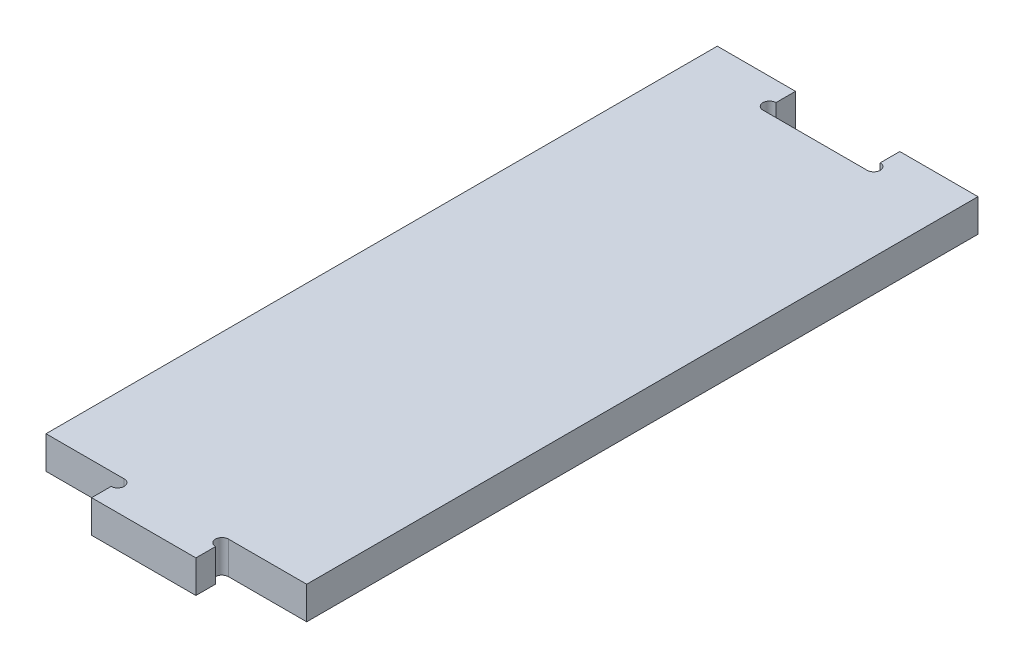
from build123d import *

# Parameters (mm, degrees)
SKETCH_1_W          = 40
SKETCH_1_H          = 103
EXTRUDE_1_DEPTH     = 5
SKETCH_2_W          = 16
SKETCH_2_H          = 5
CUT_EXTRUDE_2_DEPTH = 5
SKETCH_3_W          = 16
SKETCH_3_H          = 5
EXTRUDE_3_DEPTH     = 5
SKETCH_4_R          = 1
CUT_EXTRUDE_3_DEPTH = 10


with BuildPart() as part:
    # 스케치1 → 보스-돌출1 (new body)
    with BuildSketch(Plane(origin=(0, 0, 0), x_dir=(1, 0, 0), z_dir=(0, 1, 0))):
        with Locations((20, 51.5)):
            Rectangle(SKETCH_1_W, SKETCH_1_H)
    extrude(amount=EXTRUDE_1_DEPTH)

    # 스케치2 → 컷-돌출2 (cut)
    with BuildSketch(Plane(origin=(0, 5, 0), x_dir=(1, 0, 0), z_dir=(0, 1, 0))):
        with Locations((20, 100.5)):
            Rectangle(SKETCH_2_W, SKETCH_2_H)
    extrude(amount=-CUT_EXTRUDE_2_DEPTH, mode=Mode.SUBTRACT)

    # 스케치3 → 보스-돌출3 (add)
    with BuildSketch(Plane(origin=(0, 5, 0), x_dir=(1, 0, 0), z_dir=(0, 1, 0))):
        with Locations((20, -2.5)):
            Rectangle(SKETCH_3_W, SKETCH_3_H)
    extrude(amount=-EXTRUDE_3_DEPTH)

    # 스케치4 → 컷-돌출3 (cut)
    with BuildSketch(Plane(origin=(0, 5, 0), x_dir=(1, 0, 0), z_dir=(0, 1, 0))):
        with Locations((28, -1)):
            Circle(SKETCH_4_R)
        with Locations((12, -1)):
            Circle(SKETCH_4_R)
        with Locations((12, 99)):
            Circle(SKETCH_4_R)
        with Locations((28, 99)):
            Circle(SKETCH_4_R)
    extrude(amount=-CUT_EXTRUDE_3_DEPTH, mode=Mode.SUBTRACT)


solid = part.part
